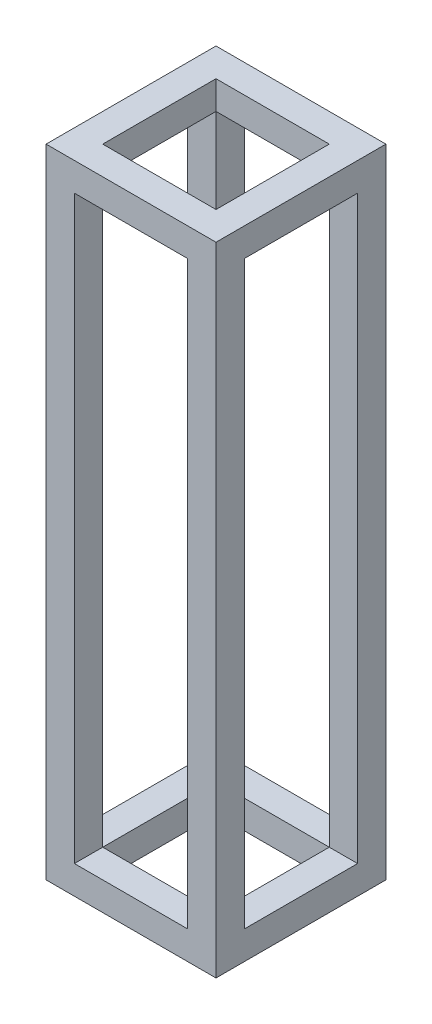
from build123d import *

# Parameters (mm, degrees)
SKETCH1_W           = 120
SKETCH1_H           = 120
SKETCH1_W_2         = 80
SKETCH1_H_2         = 80
BOSS_EXTRUDE1_DEPTH = 20
SKETCH2_W           = 20
SKETCH2_H           = 20
BOSS_EXTRUDE2_DEPTH = 450
SKETCH4_W           = 120
SKETCH4_H           = 120
SKETCH4_W_2         = 80
SKETCH4_H_2         = 80
BOSS_EXTRUDE3_DEPTH = 20


with BuildPart() as part:
    # Sketch1 → Boss-Extrude1 (new body)
    with BuildSketch(Plane(origin=(0, 0, 0), x_dir=(1, 0, 0), z_dir=(0, 1, 0))):
        Rectangle(SKETCH1_W, SKETCH1_H)
        Rectangle(SKETCH1_W_2, SKETCH1_H_2, mode=Mode.SUBTRACT)
    extrude(amount=BOSS_EXTRUDE1_DEPTH)

    # Sketch2 → Boss-Extrude2 (add)
    with BuildSketch(Plane(origin=(0, 450, 0), x_dir=(1, 0, 0), z_dir=(0, 1, 0))):
        with Locations((-50, 50)):
            Rectangle(SKETCH2_W, SKETCH2_H)
        with Locations((50, 50)):
            Rectangle(SKETCH2_W, SKETCH2_H)
        with Locations((50, -50)):
            Rectangle(SKETCH2_W, SKETCH2_H)
        with Locations((-50, -50)):
            Rectangle(SKETCH2_W, SKETCH2_H)
    extrude(amount=-BOSS_EXTRUDE2_DEPTH)

    # Sketch4 → Boss-Extrude3 (add)
    with BuildSketch(Plane(origin=(0, 450, 0), x_dir=(1, 0, 0), z_dir=(0, 1, 0))):
        Rectangle(SKETCH4_W, SKETCH4_H)
        Rectangle(SKETCH4_W_2, SKETCH4_H_2, mode=Mode.SUBTRACT)
    extrude(amount=-BOSS_EXTRUDE3_DEPTH)


solid = part.part
